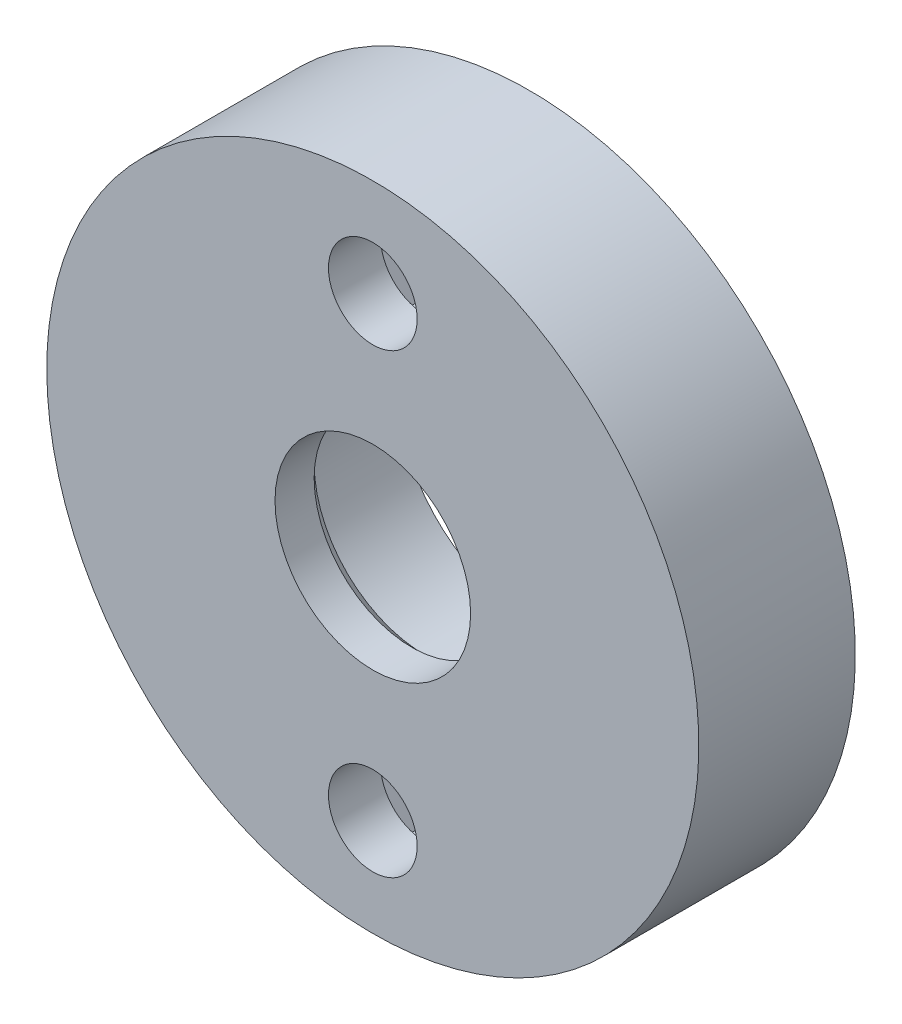
from build123d import *

# Parameters (mm, degrees)
ESQUISSE1_RX            = 12.5
ESQUISSE1_RY            = 12.5
BOSS_EXTRU_1_DEPTH      = 6
ESQUISSE2_R             = 5
ENL_V_MAT_EXTRU_1_DEPTH = 4
ENL_V_MAT_EXTRU_2_REACH = 20.125
ESQUISSE3_R             = 3.75
CHANFREIN1_SIZE         = 0.5
ENL_V_MAT_EXTRU_3_DEPTH = 4
ENL_V_MAT_EXTRU_4_REACH = 20.125
ESQUISSE6_R             = 1.7


with BuildPart() as part:
    # Esquisse1 → Boss.-Extru.1 (new body)
    with BuildSketch(Plane.XY):
        with Locations((0, 0)):
            Ellipse(ESQUISSE1_RX, ESQUISSE1_RY)
    extrude(amount=BOSS_EXTRU_1_DEPTH)

    # Esquisse2 → Enlèv. mat.-Extru.1 (cut)
    with BuildSketch(Plane(origin=(0, 0, 0), x_dir=(-1, 0, 0), z_dir=(0, 0, -1))):
        Circle(ESQUISSE2_R)
    extrude(amount=-ENL_V_MAT_EXTRU_1_DEPTH, mode=Mode.SUBTRACT)

    # Esquisse3 → Enlèv. mat.-Extru.2 (cut, up to next)
    with BuildSketch(Plane(origin=(0, 0, 4), x_dir=(-1, 0, 0), z_dir=(0, 0, -1)), mode=Mode.PRIVATE) as enl_v_mat_extru_2_sk1:
        Circle(ESQUISSE3_R)
    enl_v_mat_extru_2_tool1 = extrude(enl_v_mat_extru_2_sk1.sketch, amount=-ENL_V_MAT_EXTRU_2_REACH, mode=Mode.PRIVATE) & part.part
    add(enl_v_mat_extru_2_tool1.solids().sort_by_distance((0, 0, 4))[0], mode=Mode.SUBTRACT)

    # Chanfrein1
    chanfrein1_edges = [part.edges().sort_by_distance(p)[0] for p in [
        (3.75, 0, 4),
    ]]
    chamfer(chanfrein1_edges, length=CHANFREIN1_SIZE)

    # Esquisse5 → Enlèv. mat.-Extru.3 (cut)
    with BuildSketch(Plane(origin=(0, 0, 0), x_dir=(-1, 0, 0), z_dir=(0, 0, -1))):
        Polygon((-3.117691454, -8.75), (-1.558845727, -11.45), (1.558845727, -11.45), (3.117691454, -8.75), (1.558845727, -6.05), (-1.558845727, -6.05), align=None)
        Polygon((3.117691454, 8.75), (1.558845727, 11.45), (-1.558845727, 11.45), (-3.117691454, 8.75), (-1.558845727, 6.05), (1.558845727, 6.05), align=None)
    extrude(amount=-ENL_V_MAT_EXTRU_3_DEPTH, mode=Mode.SUBTRACT)

    # Esquisse6 → Enlèv. mat.-Extru.4 (cut, up to next)
    with BuildSketch(Plane(origin=(0, 0, 4), x_dir=(-1, 0, 0), z_dir=(0, 0, -1)), mode=Mode.PRIVATE) as enl_v_mat_extru_4_sk1:
        with Locations((0, 8.75)):
            Circle(ESQUISSE6_R)
    enl_v_mat_extru_4_tool1 = extrude(enl_v_mat_extru_4_sk1.sketch, amount=-ENL_V_MAT_EXTRU_4_REACH, mode=Mode.PRIVATE) & part.part
    # Esquisse6 → Enlèv. mat.-Extru.4 (cut, up to next)
    with BuildSketch(Plane(origin=(0, 0, 4), x_dir=(-1, 0, 0), z_dir=(0, 0, -1)), mode=Mode.PRIVATE) as enl_v_mat_extru_4_sk2:
        with Locations((0, -8.75)):
            Circle(ESQUISSE6_R)
    enl_v_mat_extru_4_tool2 = extrude(enl_v_mat_extru_4_sk2.sketch, amount=-ENL_V_MAT_EXTRU_4_REACH, mode=Mode.PRIVATE) & part.part
    add(enl_v_mat_extru_4_tool1.solids().sort_by_distance((0, 8.75, 4))[0], mode=Mode.SUBTRACT)
    add(enl_v_mat_extru_4_tool2.solids().sort_by_distance((0, -8.75, 4))[0], mode=Mode.SUBTRACT)


solid = part.part
